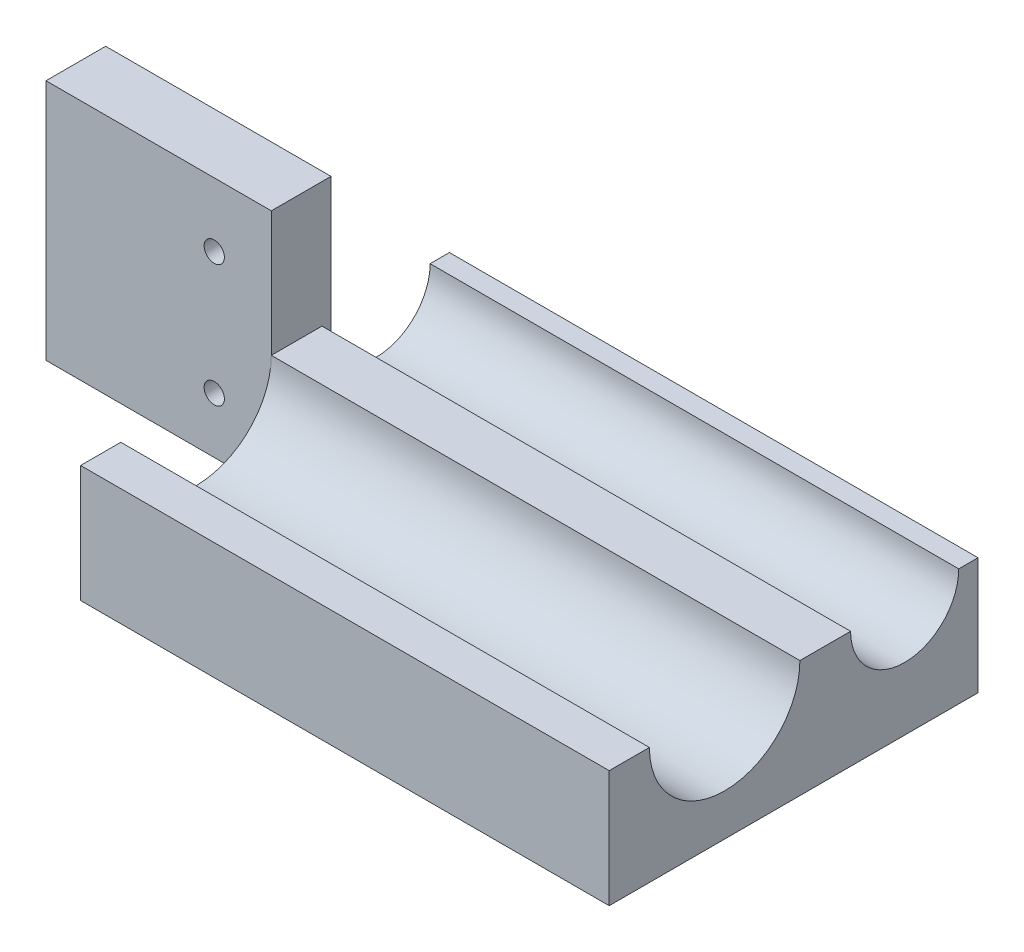
from build123d import *

# Parameters (mm, degrees)
BOSS_EXTRUDE1_DEPTH = 117.3
SKETCH7_W           = 13.242480008
SKETCH7_H           = 53.740928499
BOSS_EXTRUDE2_DEPTH = 50
SKETCH8_R           = 2.25
CUT_EXTRUDE1_DEPTH  = 13.242480008
SKETCH9_R           = 5.25
SKETCH9_R_2         = 4.930225291
CUT_EXTRUDE2_DEPTH  = 4.5


with BuildPart() as part:
    # Sketch1 → Boss-Extrude1 (new body)
    with BuildSketch(Plane(origin=(0, 0, 0), x_dir=(0, 0, -1), z_dir=(1, 0, 0))):
        with BuildLine():
            Line((0, 0), (81.840140947, 0))
            Line((81.840140947, 0), (81.840140947, 25.960755084))
            Line((81.840140947, 25.960755084), (77.562505861, 25.960755084))
            ThreePointArc((77.562505861, 25.960755084), (65.562505861, 13.960755084), (53.562505861, 25.960755084))
            Line((53.562505861, 25.960755084), (42.320025853, 25.960755084))
            ThreePointArc((42.320025853, 25.960755084), (25.620025853, 9.260755084), (8.920025853, 25.960755084))
            Line((8.920025853, 25.960755084), (0, 25.960755084))
            Line((0, 25.960755084), (0, 0))
        make_face()
    extrude(amount=BOSS_EXTRUDE1_DEPTH)

    # Sketch7 → Boss-Extrude2 (add)
    with BuildSketch(Plane.ZY):
        with Locations((-48.941265857, 26.87046425)):
            Rectangle(SKETCH7_W, SKETCH7_H)
    extrude(amount=BOSS_EXTRUDE2_DEPTH)

    # Sketch8 → Cut-Extrude1 (cut)
    with BuildSketch(Plane(origin=(0, 0, -55.562505861), x_dir=(-1, 0, 0), z_dir=(0, 0, -1))):
        with Locations((12.663905134, 39.560755084)):
            Circle(SKETCH8_R)
        with Locations((12.663905134, 12.360755084)):
            Circle(SKETCH8_R)
    extrude(amount=-CUT_EXTRUDE1_DEPTH, mode=Mode.SUBTRACT)

    # Sketch9 → Cut-Extrude2 (cut)
    with BuildSketch(Plane(origin=(0, 0, -55.562505861), x_dir=(-1, 0, 0), z_dir=(0, 0, -1))):
        with Locations((12.663905134, 39.560755084)):
            Circle(SKETCH9_R)
        with Locations((12.663905134, 12.360755084)):
            Circle(SKETCH9_R_2)
    extrude(amount=-CUT_EXTRUDE2_DEPTH, mode=Mode.SUBTRACT)


solid = part.part
